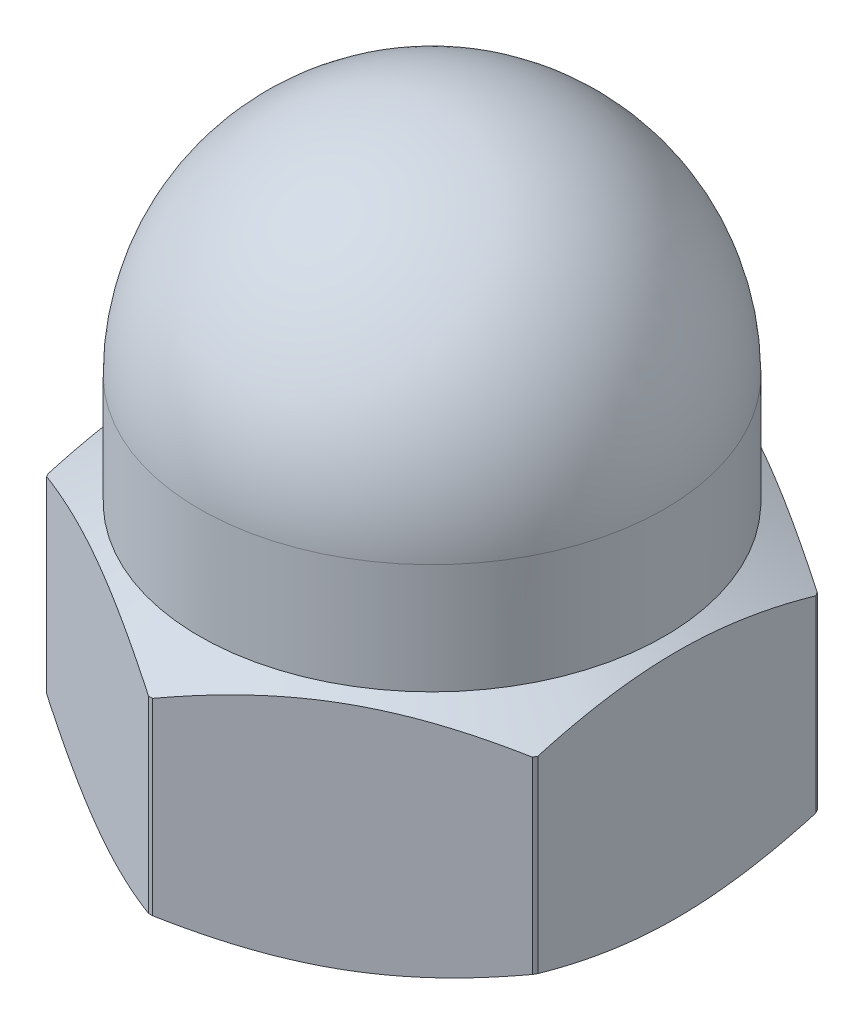
from build123d import *

# Parameters (mm, degrees)
SKETCH_2_OUTSIDE_W  = 17.542
SKETCH_2_OUTSIDE_H  = 17.542
CUT_EXTRUDE_1_DEPTH = 15.495689014
CHAMFER_1_SIZE      = 0.6


with BuildPart() as part:
    # Эскиз1 → Revolve 782 (revolve)
    with BuildSketch(Plane.XY, mode=Mode.PRIVATE) as revolve_782_sk:
        with BuildLine():
            Line((5.75, 0.577350269), (5.75, 4.422649731))
            Line((5.75, 4.422649731), (4.75, 5))
            Line((4.75, 5), (4.75, 7.25))
            ThreePointArc((4.75, 7.25), (3.358757211, 10.608757211), (0, 12))
            Line((0, 12), (0, 10))
            Line((0, 10), (2.6, 8))
            Line((2.6, 8), (2.6, 0))
            Line((2.6, 0), (4.75, 0))
            Line((4.75, 0), (5.75, 0.577350269))
        make_face()
    revolve(revolve_782_sk.sketch.rotate(Axis((0, 18.372325569, 0), (0, -1, 0)), 180), axis=Axis((0, 18.372325569, 0), (0, -1, 0)))

    # Эскиз2 outside → Вырез-Вытянуть1 (cut, through all)
    with BuildSketch(Plane(origin=(0, 0, 0), x_dir=(1, 0, 0), z_dir=(0, 1, 0))):
        Rectangle(SKETCH_2_OUTSIDE_W, SKETCH_2_OUTSIDE_H)
        Polygon((0, 5.773502692), (-5, 2.886751346), (-5, -2.886751346), (0, -5.773502692), (5, -2.886751346), (5, 2.886751346), align=None, mode=Mode.SUBTRACT)
    extrude(amount=CUT_EXTRUDE_1_DEPTH, mode=Mode.SUBTRACT)

    # Фаска1
    chamfer_1_edges = [part.edges().sort_by_distance(p)[0] for p in [
        (2.6, 0, 0),
    ]]
    chamfer(chamfer_1_edges, length=CHAMFER_1_SIZE)


solid = part.part
